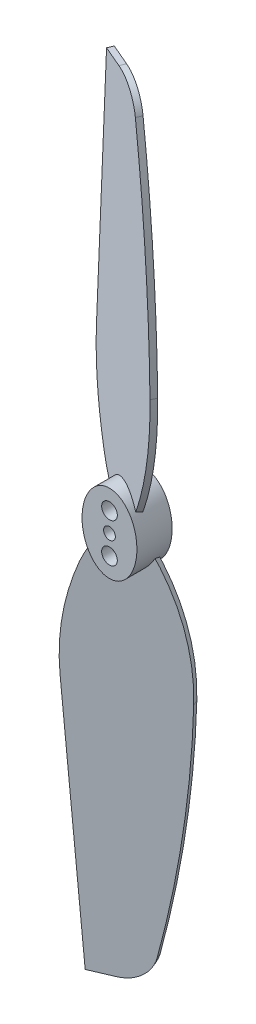
from build123d import *

# Parameters (mm, degrees)
BASE_CYL_DEPTH      = 4.5
PROPELLER_1_DEPTH   = 0.375
FLIP_ROTATION_ANGLE = 46.397181
SKETCH6_R           = 0.75
SKETCH6_R_2         = 1
HOLES_DEPTH         = 51.672574183


with BuildPart() as part:
    # Sketch1 → base cyl (new body)
    with BuildSketch(Plane(origin=(0, 0, 0), x_dir=(0, 1, 0), z_dir=(0, 0, 1))):
        with BuildLine():
            Line((0, 3.5), (0, -3.5))
            add(Edge.make_bspline(
                [(0, -3.5), (5, -3.5), (5, 0), (5, 3.5), (0, 3.5)],
                knots=[1.570796327, 1.570796327, 1.570796327, 3.141592654, 3.141592654, 4.71238898, 4.71238898, 4.71238898], degree=2, weights=[1, 0.707106781, 1, 0.707106781, 1]))
        make_face()
    extrude(amount=BASE_CYL_DEPTH)

    # mirror cyl: part across plane


with BuildPart() as body_2:
    # Sketch3 → propeller 1 (new, symmetric)
    with BuildSketch(Plane(origin=(-0.814655172, 0, 1.900862069), x_dir=(0.9191450300180579, 0, 0.39391929857916774), z_dir=(-0.39391929857916774, 0, 0.919145030018058))):
        with BuildLine():
            Line((-5.613681578, 18), (-3.169992707, 50))
            Line((-3.169992707, 50), (-0.169992707, 50))
            ThreePointArc((-0.169992707, 50), (2.38691804, 49.155307497), (3.830007293, 46.881809881))
            ThreePointArc((3.830007293, 46.881809881), (6.330689995, 32.529872056), (7.386318422, 18))
            ThreePointArc((7.386318422, 18), (6.084481394, 8.557505759), (1.886318422, 0))
            Line((1.886318422, 0), (-0.113681578, 0))
            ThreePointArc((-0.113681578, 0), (-2.2443271, 2.26430716), (-3.721730883, 5))
            ThreePointArc((-3.721730883, 5), (-5.38802994, 11.395167927), (-5.613681578, 18))
        make_face()
    extrude(amount=PROPELLER_1_DEPTH, both=True)


with BuildPart() as body_3:
    # mirror propeller: mirrored copy
    add(body_2.part.mirror(Plane(origin=(-3.5, 0, 4.5), x_dir=(0, 0, 1), z_dir=(0, 1, 0))))


with BuildPart() as body_3_1:
    # flip rotation: moved
    add(body_3.part.rotate(Axis((0.214116178, 0, 1.999751921), (0, 1, 0)), FLIP_ROTATION_ANGLE))


with BuildPart() as part_1:
    add(part.part)
    add(part.part.mirror(Plane(origin=(-3.5, 0, 4.5), x_dir=(0, 0, 1), z_dir=(0, 1, 0))))


with BuildPart() as holes_tool:
    # Sketch6 → holes (new, through all)
    with BuildSketch(Plane.XY.offset(4.5)):
        Circle(SKETCH6_R)
        with Locations((0, 2.5)):
            Circle(SKETCH6_R_2)
        with Locations((0, -2.5)):
            Circle(SKETCH6_R_2)
    extrude(amount=-HOLES_DEPTH)


with BuildPart() as part_2:
    add(part_1.part)

    # holes: cut by holes_tool
    add(holes_tool.part, mode=Mode.SUBTRACT)


with BuildPart() as body_2_1:
    add(body_2.part)

    # holes: cut by holes_tool
    add(holes_tool.part, mode=Mode.SUBTRACT)


with BuildPart() as body_3_2:
    add(body_3_1.part)

    # holes: cut by holes_tool
    add(holes_tool.part, mode=Mode.SUBTRACT)


solid = Compound([part_2.part, body_2_1.part, body_3_2.part])
